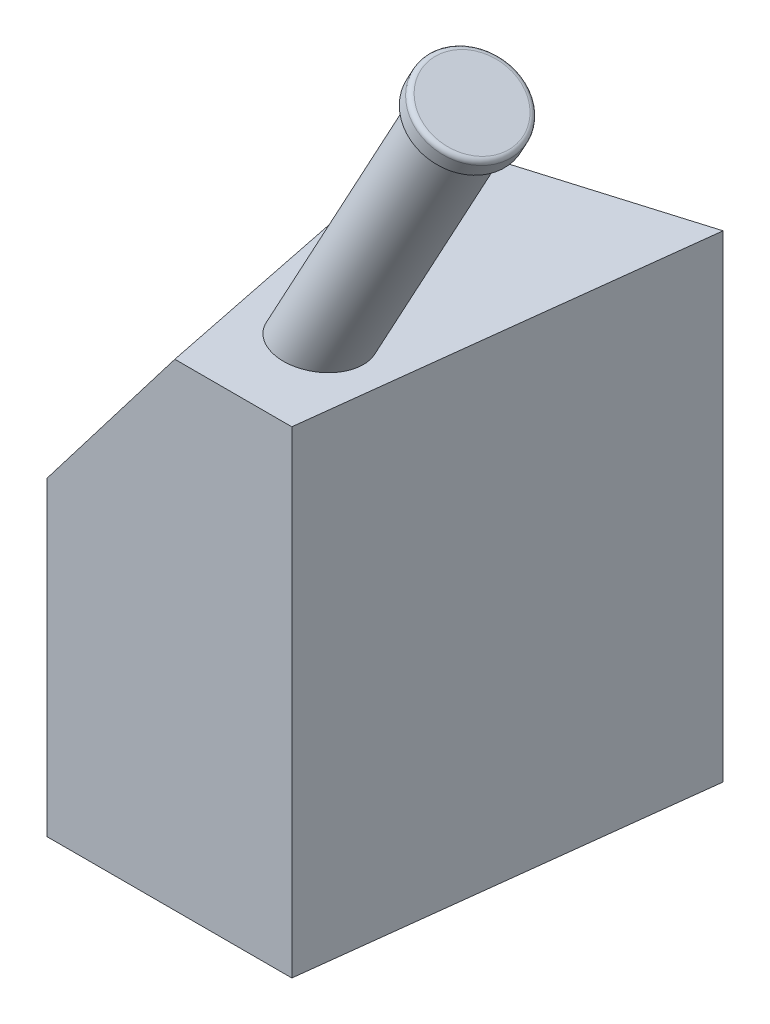
from build123d import *

# Parameters (mm, degrees)
BOSS_EXTRUDE1_DEPTH      = 254
BOSS_EXTRUDE2_DEPTH      = 165.1
BOSS_EXTRUDE2_DEPTH_BACK = 50.8
SKETCH16_R               = 20.3962
SKETCH17_R               = 25.4762
BOSS_EXTRUDE3_DEPTH      = 10.16
FILLET1_R                = 2.54
CUT_EXTRUDE5_DEPTH       = 518.859576594
CUT_EXTRUDE14_DEPTH      = 516.224718622
CUT_EXTRUDE16_DEPTH      = 488.341428789


with BuildPart() as part:
    # Sketch2 → Boss-Extrude1 (new body)
    with BuildSketch(Plane(origin=(0, 0, 0), x_dir=(1, 0, 0), z_dir=(0, 1, 0))):
        Polygon((0, 0), (130.302, 0), (154.729351402, 205.052140948), (-52.123869843, 143.209155408), align=None)
    extrude(amount=BOSS_EXTRUDE1_DEPTH)

    # Sketch16 → Boss-Extrude2 (add, two sides: drawn at the far end of the back side and taken through both)
    with BuildSketch(Plane(origin=(141.332693429, 246.526276938, 16.836612147), x_dir=(0.11829111292954252, 0, -0.9929789587911166), z_dir=(0.4964894793955593, 0.8660254037844382, 0.059145556464771376)).offset(-BOSS_EXTRUDE2_DEPTH_BACK)):
        with Locations(Location((59.539258978, 48.389402794, 0), (0, 0, 95.890220986))):
            Circle(SKETCH16_R)
    extrude(amount=BOSS_EXTRUDE2_DEPTH + BOSS_EXTRUDE2_DEPTH_BACK)

    # Sketch17 → Boss-Extrude3 (add)
    with BuildSketch(Plane(origin=(223.303106477, 389.507071103, 26.601543519), x_dir=(0.8680427390684899, -0.49533563558134813, -0.0338291482851031), z_dir=(0.49648947939555943, 0.866025403784438, 0.0591455564647714))):
        with Locations(Location((-39.824375463, 65.578020566, 0), (0, 0, 178.057961601))):
            Circle(SKETCH17_R)
    extrude(amount=-BOSS_EXTRUDE3_DEPTH)

    # Fillet1
    fillet1_edges = [part.edges().sort_by_distance(p)[0] for p in [
        (201.384117467, 394.758696828, -38.077767579),
        (210.835574876, 401.03092525, -37.476848726),
    ]]
    fillet(fillet1_edges, radius=FILLET1_R)

    # Sketch37 → Cut-Extrude5 (cut, through all)
    with BuildSketch(Plane(origin=(-74.235573647, 46.74358774, 4.634969946), x_dir=(0.044647299319108304, -0.028112868945999136, 0.9986071726475507), z_dir=(-0.8450404746161061, 0.5320929256471292, 0.052760920546034554))):
        Polygon((-177.193506747, 239.03382897), (-117.503506747, 239.03382897), (-4.641434663, 139.710775348), (-148.050333908, 53.903642677), align=None)
    extrude(amount=CUT_EXTRUDE5_DEPTH, mode=Mode.SUBTRACT)

    # Sketch44 → Cut-Extrude14 (cut, through all)
    with BuildSketch(Plane(origin=(-77.674407605, 59.476403537, 15.773333495), x_dir=(-0.1263811849383747, 0.0967718787528128, -0.9872502213604327), z_dir=(0.7838483769002791, -0.6002039000265006, -0.1591760045477231))):
        Polygon((129.968891102, 229.15973728), (15.977037182, 243.05344524), (15.977037182, 131.08466752), align=None)
    extrude(amount=-CUT_EXTRUDE14_DEPTH, mode=Mode.SUBTRACT)


with BuildPart() as cut_extrude14_piece_1:
    # of the separate pieces the step leaves, piece 1, a body of its own (cut_extrude14_pieces)
    add(part.part.solids().sort_by_distance((164.733826071, 412.847507441, -38.227997293))[0])


with BuildPart() as cut_extrude14_piece_2:
    # of the separate pieces the step leaves, piece 2, a body of its own (cut_extrude14_pieces)
    add(part.part.solids().sort_by_distance((-24.451989708, 254, -67.181289582))[0])

    # Sketch54 → Cut-Extrude16 (cut, through all)
    with BuildSketch(Plane(origin=(48.324107263, 47.921039084, 57.272316376), x_dir=(0.8395487608428681, -0.34863488518909047, -0.4166672473286021), z_dir=(0.5432843437530708, 0.5387528450113599, 0.6438846898513436))):
        Polygon((-57.559619545, 126.622022749), (-3.698754498, 267.020987435), (-89.385563224, 299.892779983), (-143.246428271, 159.493815297), align=None)
    extrude(amount=-CUT_EXTRUDE16_DEPTH, mode=Mode.SUBTRACT)


solid = cut_extrude14_piece_1.part
